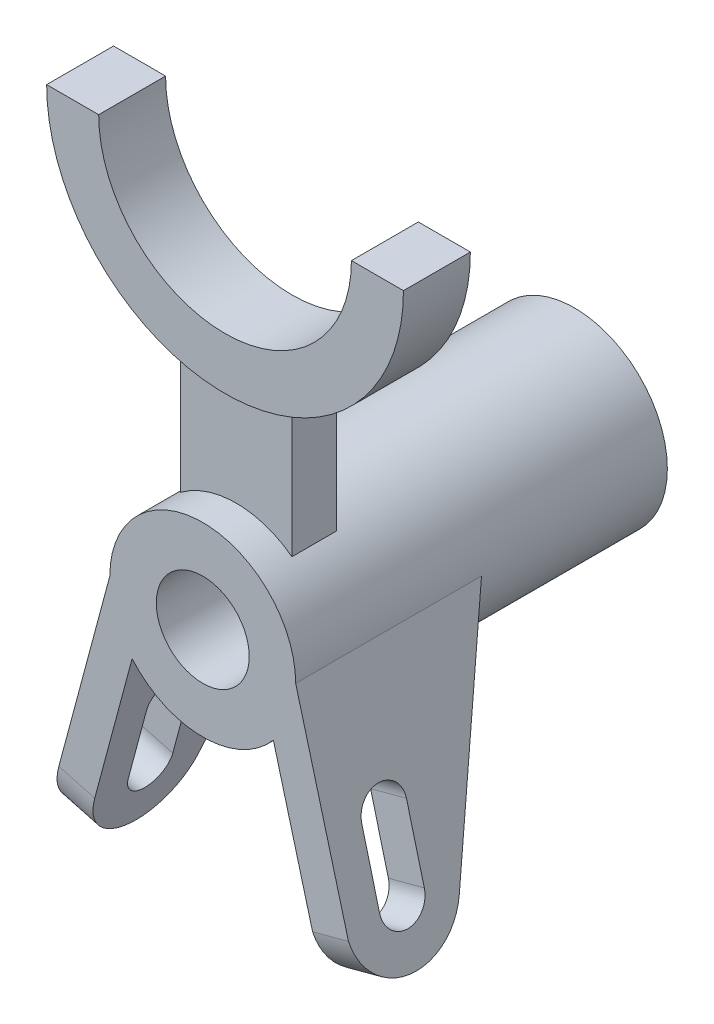
from build123d import *

# Parameters (mm, degrees)
BOSS_EXTRUDE1_DEPTH        = 9
BOSS_EXTRUDE2_DEPTH        = 6
BOSS_EXTRUDE3_DEPTH        = 15
BOSS_EXTRUDE3_DEPTH_BACK   = 85
BOSS_EXTRUDE4_DEPTH        = 15
BOSS_EXTRUDE4_DEPTH_BACK   = 35
CUT_EXTRUDE1_DEPTH         = 10
CUT_EXTRUDE2_DEPTH         = 10
BOSS_EXTRUDE6_DEPTH        = 15
BOSS_EXTRUDE6_DEPTH_BACK   = 85
SKETCH1_6_R                = 25
F_25_0_25_DIAMETER_HOLE1_D = 25


with BuildPart() as part:
    # Sketch1 → Boss-Extrude1 (new, symmetric)
    with BuildSketch(Plane.XY):
        with BuildLine():
            Line((-48, 100), (-34, 100))
            ThreePointArc((-34, 100), (0, 66), (34, 100))
            Line((34, 100), (48, 100))
            ThreePointArc((48, 100), (0, 52), (-48, 100))
        make_face()
    extrude(amount=BOSS_EXTRUDE1_DEPTH, both=True)

    # Sketch1<3> → Boss-Extrude2 (add, symmetric)
    with BuildSketch(Plane.XY):
        with BuildLine():
            ThreePointArc((15, 54.403947539), (0, 52), (-15, 54.403947539))
            Line((-15, 54.403947539), (-15, 20))
            ThreePointArc((-15, 20), (0, 25), (15, 20))
            Line((15, 20), (15, 54.403947539))
        make_face()
    extrude(amount=BOSS_EXTRUDE2_DEPTH, both=True)

    # Sketch1<4> → Boss-Extrude3 (add, two sides: drawn at the far end of the back side and taken through both)
    with BuildSketch(Plane.XY.offset(-BOSS_EXTRUDE3_DEPTH_BACK)):
        with BuildLine():
            Line((-15.340741737, -2.588190451), (-25, 0))
            ThreePointArc((-25, 0), (-23.452260867, -8.659760979), (-19.000683183, -16.247277882))
            Line((-19.000683183, -16.247277882), (-15.340741737, -2.588190451))
        make_face()
        with BuildLine():
            ThreePointArc((19.000683183, -16.247277882), (23.452260867, -8.659760979), (25, 0))
            Line((25, 0), (15.340741737, -2.588190451))
            Line((15.340741737, -2.588190451), (19.000683183, -16.247277882))
        make_face()
        with BuildLine():
            ThreePointArc((15, 20), (0, 25), (-15, 20))
            ThreePointArc((-15, 20), (-22.360679775, 11.180339887), (-25, 0))
            Line((-25, 0), (-15.340741737, -2.588190451))
            Line((-15.340741737, -2.588190451), (-19.000683183, -16.247277882))
            ThreePointArc((-19.000683183, -16.247277882), (0, -25), (19.000683183, -16.247277882))
            Line((19.000683183, -16.247277882), (15.340741737, -2.588190451))
            Line((15.340741737, -2.588190451), (25, 0))
            ThreePointArc((25, 0), (22.360679775, 11.180339887), (15, 20))
        make_face()
    extrude(amount=BOSS_EXTRUDE3_DEPTH + BOSS_EXTRUDE3_DEPTH_BACK)

    # Sketch1<5> → Boss-Extrude4 (add, two sides: drawn at the far end of the back side and taken through both)
    with BuildSketch(Plane.XY.offset(-BOSS_EXTRUDE4_DEPTH_BACK)):
        with BuildLine():
            ThreePointArc((-19.000683183, -16.247277882), (-23.452260867, -8.659760979), (-25, 0))
            Line((-25, 0), (-42.599695067, -65.682956188))
            Line((-42.599695067, -65.682956188), (-32.940436804, -68.271146639))
            Line((-32.940436804, -68.271146639), (-19.000683183, -16.247277882))
        make_face()
        with BuildLine():
            Line((42.599695067, -65.682956188), (25, 0))
            ThreePointArc((25, 0), (23.452260867, -8.659760979), (19.000683183, -16.247277882))
            Line((19.000683183, -16.247277882), (32.940436804, -68.271146639))
            Line((32.940436804, -68.271146639), (42.599695067, -65.682956188))
        make_face()
    extrude(amount=BOSS_EXTRUDE4_DEPTH + BOSS_EXTRUDE4_DEPTH_BACK)

    # Sketch3 → Cut-Extrude1 (cut)
    with BuildSketch(Plane(origin=(-23.325317547, 6.25, 0), x_dir=(0, 0, 1), z_dir=(-0.9659258262890681, 0.2588190451025213, 0))):
        with BuildLine():
            Line((-14.115045046, -64.546449271), (-35, -6.470476128))
            Line((-35, -6.470476128), (-35, -74.470476128))
            Line((-35, -74.470476128), (1.18e-07, -74.470476128))
            ThreePointArc((1.18e-07, -74.470476128), (-8.627293932, -71.741164756), (-14.115045046, -64.546449271))
        make_face()
        with BuildLine():
            Line((15, -74.470476128), (15, -59.470476128))
            ThreePointArc((15, -59.470476128), (10.60660176, -70.077077804), (1.18e-07, -74.470476128))
            Line((1.18e-07, -74.470476128), (15, -74.470476128))
        make_face()
        with BuildLine():
            Line((-6, -40.470476128), (-6, -59.470476128))
            ThreePointArc((-6, -59.470476128), (0, -65.470476128), (6, -59.470476128))
            Line((6, -59.470476128), (6, -40.470476128))
            ThreePointArc((6, -40.470476128), (0, -34.470476128), (-6, -40.470476128))
        make_face()
    extrude(amount=-CUT_EXTRUDE1_DEPTH, mode=Mode.SUBTRACT)

    # Sketch4 → Cut-Extrude2 (cut)
    with BuildSketch(Plane(origin=(23.325317547, 6.25, 0), x_dir=(0, 0, -1), z_dir=(0.9659258262890681, 0.2588190451025213, 0))):
        with BuildLine():
            Line((35, -74.470476128), (35, -6.470476128))
            Line((35, -6.470476128), (13.986332308, -64.572126035))
            ThreePointArc((13.986332308, -64.572126035), (8.496673309, -71.749009188), (-0.119452585, -74.470476128))
            Line((-0.119452585, -74.470476128), (35, -74.470476128))
        make_face()
        with BuildLine():
            ThreePointArc((-0.119452585, -74.470476128), (-10.03562817, -70.725229004), (-15, -61.359737742))
            Line((-15, -61.359737742), (-15, -74.470476128))
            Line((-15, -74.470476128), (-0.119452585, -74.470476128))
        make_face()
        with BuildLine():
            Line((-5.999881425, -40.432754995), (-6.119334038, -59.432754995))
            ThreePointArc((-6.119334038, -59.432754995), (-0.157173745, -65.470357553), (5.880428813, -59.50819726))
            Line((5.880428813, -59.50819726), (5.999881425, -40.50819726))
            ThreePointArc((5.999881425, -40.50819726), (0.037721132, -34.470594702), (-5.999881425, -40.432754995))
        make_face()
    extrude(amount=-CUT_EXTRUDE2_DEPTH, mode=Mode.SUBTRACT)

    # Sketch1<6> → Boss-Extrude6 (add, two sides: drawn at the far end of the back side and taken through both)
    with BuildSketch(Plane.XY.offset(-BOSS_EXTRUDE6_DEPTH_BACK)):
        Circle(SKETCH1_6_R)
    extrude(amount=BOSS_EXTRUDE6_DEPTH + BOSS_EXTRUDE6_DEPTH_BACK)

    # Ø25.0 (25) Diameter Hole1 (through all)
    with Locations(Plane(origin=(0, 0, -85), x_dir=(-1, 0, 0), z_dir=(0, 0, -1))):
        with Locations((0, 0)):
            Hole(F_25_0_25_DIAMETER_HOLE1_D / 2)


solid = part.part
